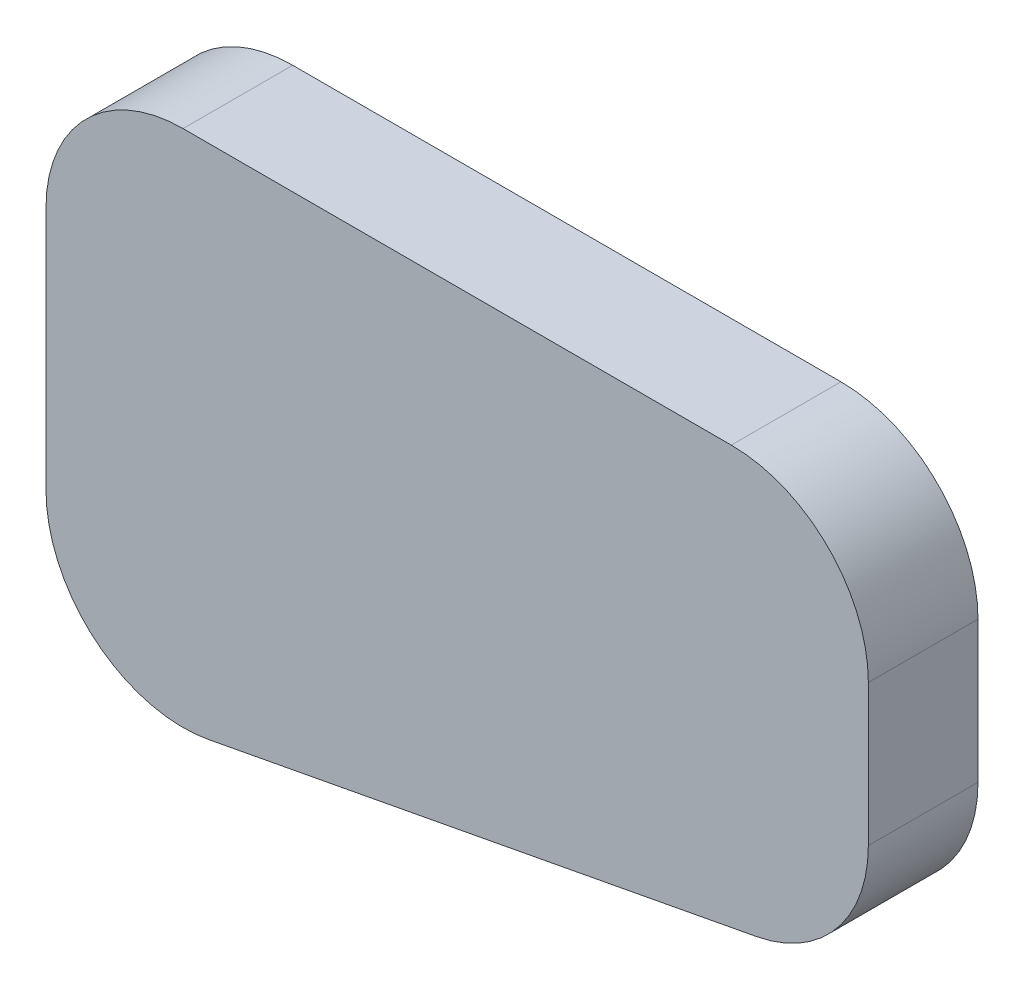
from build123d import *

# Parameters (mm, degrees)
BOSS_EXTRUDE1_DEPTH = 2.54


with BuildPart() as part:
    # Sketch1 → Boss-Extrude1 (new body)
    with BuildSketch(Plane.XY):
        with BuildLine():
            Line((92.005582605, -41.843566694), (92.005582605, -38.571829034))
            ThreePointArc((92.005582605, -38.571829034), (91.075646636, -36.326765003), (88.830582605, -35.396829034))
            Line((88.830582605, -35.396829034), (76.130582605, -35.396829034))
            ThreePointArc((76.130582605, -35.396829034), (73.885518575, -36.326765003), (72.955582605, -38.571829034))
            Line((72.955582605, -38.571829034), (72.955582605, -44.238884811))
            ThreePointArc((72.955582605, -44.238884811), (74.104221085, -46.683160571), (76.719037087, -47.358876209))
            Line((76.719037087, -47.358876209), (89.419037087, -44.963558092))
            ThreePointArc((89.419037087, -44.963558092), (91.274858365, -43.869928214), (92.005582605, -41.843566694))
        make_face()
    extrude(amount=BOSS_EXTRUDE1_DEPTH)


solid = part.part
